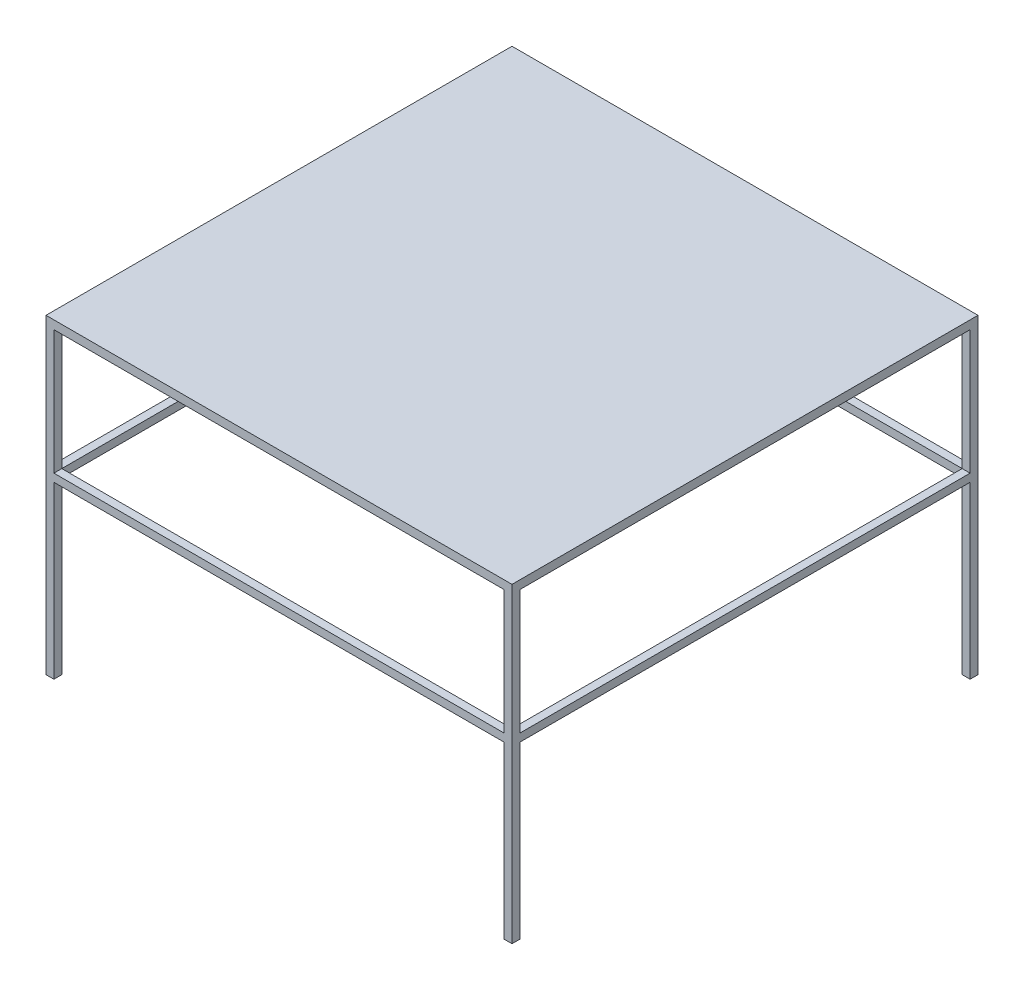
from build123d import *

# Parameters (mm, degrees)
CROQUIS1_W                = 25.4
CROQUIS1_H                = 25.4
SALIENTE_EXTRUIR1_DEPTH   = 1000
SALIENTE_EXTRUIR1_2_DEPTH = 1000
SALIENTE_EXTRUIR1_3_DEPTH = 1000
SALIENTE_EXTRUIR1_4_DEPTH = 1000
CROQUIS3_W                = 1449.2
CROQUIS3_H                = 25.4
SALIENTE_EXTRUIR2_DEPTH   = 25.4
CROQUIS4_W                = 1449.2
CROQUIS4_H                = 25.4
SALIENTE_EXTRUIR3_DEPTH   = 25.4
CROQUIS5_W                = 1449.2
CROQUIS5_H                = 25.4
SALIENTE_EXTRUIR4_DEPTH   = 25.4
CROQUIS6_W                = 1449.2
CROQUIS6_H                = 25.4
SALIENTE_EXTRUIR5_DEPTH   = 25.4
CROQUIS7_W                = 1500
CROQUIS7_H                = 1500
SALIENTE_EXTRUIR6_DEPTH   = 1.9


with BuildPart() as part:
    # Croquis1 → Saliente-Extruir1 (new body)
    with BuildSketch(Plane(origin=(0, 0, 0), x_dir=(1, 0, 0), z_dir=(0, 1, 0))):
        with Locations((12.7, -12.7)):
            Rectangle(CROQUIS1_W, CROQUIS1_H)
    extrude(amount=SALIENTE_EXTRUIR1_DEPTH)



with BuildPart() as body_2:
    # Croquis1 → Saliente-Extruir1 2 (new body)
    with BuildSketch(Plane(origin=(0, 0, 0), x_dir=(1, 0, 0), z_dir=(0, 1, 0))):
        with Locations((1487.3, -12.7)):
            Rectangle(CROQUIS1_W, CROQUIS1_H)
    extrude(amount=SALIENTE_EXTRUIR1_2_DEPTH)



with BuildPart() as body_3:
    # Croquis1 → Saliente-Extruir1 3 (new body)
    with BuildSketch(Plane(origin=(0, 0, 0), x_dir=(1, 0, 0), z_dir=(0, 1, 0))):
        with Locations((1487.3, -1487.3)):
            Rectangle(CROQUIS1_W, CROQUIS1_H)
    extrude(amount=SALIENTE_EXTRUIR1_3_DEPTH)



with BuildPart() as body_4:
    # Croquis1 → Saliente-Extruir1 4 (new body)
    with BuildSketch(Plane(origin=(0, 0, 0), x_dir=(1, 0, 0), z_dir=(0, 1, 0))):
        with Locations((12.7, -1487.3)):
            Rectangle(CROQUIS1_W, CROQUIS1_H)
    extrude(amount=SALIENTE_EXTRUIR1_4_DEPTH)


with BuildPart() as body_3_1:
    add(body_3.part)

    add(body_4.part)  # Saliente-Extruir2 merges body 4
    # Croquis3 → Saliente-Extruir2 (add)
    with BuildSketch(Plane.XY.offset(1500)):
        with Locations((750, 987.3)):
            Rectangle(CROQUIS3_W, CROQUIS3_H)
        with Locations((750, 561.9)):
            Rectangle(CROQUIS3_W, CROQUIS3_H)
    extrude(amount=-SALIENTE_EXTRUIR2_DEPTH)


with BuildPart() as body_2_1:
    add(body_2.part)

    add(body_3_1.part)  # Saliente-Extruir3 merges body 3
    # Croquis4 → Saliente-Extruir3 (add)
    with BuildSketch(Plane(origin=(1500, 0, 0), x_dir=(0, 0, -1), z_dir=(1, 0, 0))):
        with Locations((-750, 987.3)):
            Rectangle(CROQUIS4_W, CROQUIS4_H)
        with Locations((-750, 561.9)):
            Rectangle(CROQUIS4_W, CROQUIS4_H)
    extrude(amount=-SALIENTE_EXTRUIR3_DEPTH)


with BuildPart() as part_1:
    add(part.part)

    add(body_2_1.part)  # Saliente-Extruir4 merges body 2
    # Croquis5 → Saliente-Extruir4 (add)
    with BuildSketch(Plane(origin=(0, 0, 0), x_dir=(-1, 0, 0), z_dir=(0, 0, -1))):
        with Locations((-750, 987.3)):
            Rectangle(CROQUIS5_W, CROQUIS5_H)
        with Locations((-750, 561.9)):
            Rectangle(CROQUIS5_W, CROQUIS5_H)
    extrude(amount=-SALIENTE_EXTRUIR4_DEPTH)

    # Croquis6 → Saliente-Extruir5 (add)
    with BuildSketch(Plane.ZY):
        with Locations((750, 987.3)):
            Rectangle(CROQUIS6_W, CROQUIS6_H)
        with Locations((750, 561.9)):
            Rectangle(CROQUIS6_W, CROQUIS6_H)
    extrude(amount=-SALIENTE_EXTRUIR5_DEPTH)

    # Croquis7 → Saliente-Extruir6 (add)
    with BuildSketch(Plane(origin=(0, 1000, 0), x_dir=(1, 0, 0), z_dir=(0, 1, 0))):
        with Locations((750, -750)):
            Rectangle(CROQUIS7_W, CROQUIS7_H)
    extrude(amount=SALIENTE_EXTRUIR6_DEPTH)


solid = part_1.part
